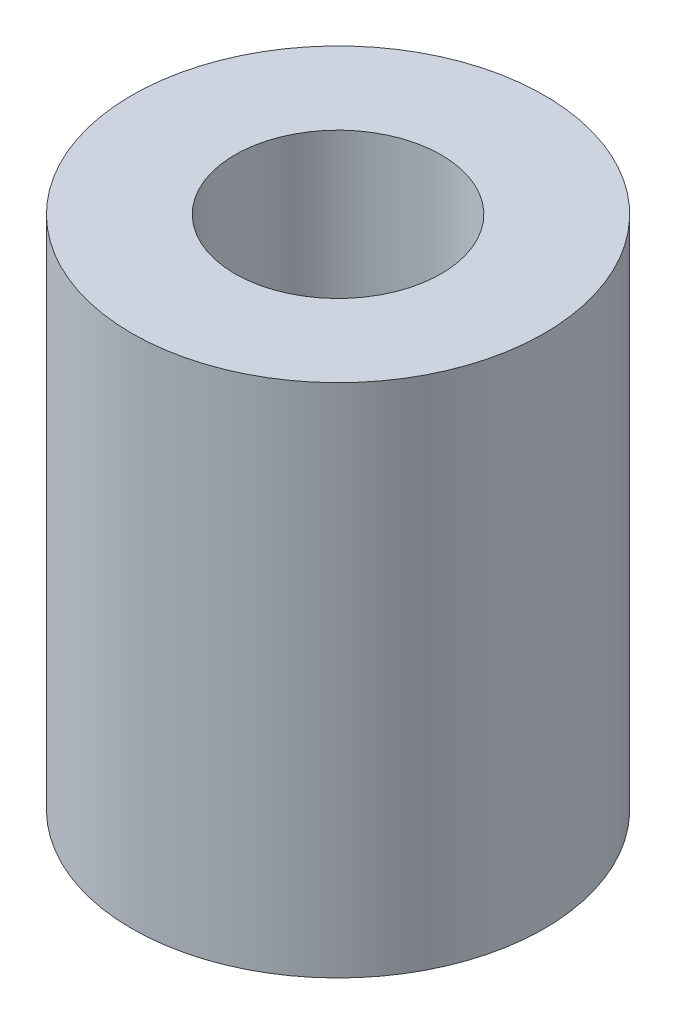
from build123d import *

# Parameters (mm, degrees)
SKETCH1_R           = 2
SKETCH1_R_2         = 1
BOSS_EXTRUDE1_DEPTH = 5


with BuildPart() as part:
    # Sketch1 → Boss-Extrude1 (new body)
    with BuildSketch(Plane(origin=(0, 0, 0), x_dir=(1, 0, 0), z_dir=(0, 1, 0))):
        with Locations(Location((0, 0, 0), (0, 0, 270))):
            Circle(SKETCH1_R)
        with Locations(Location((0, 0, 0), (0, 0, 270))):
            Circle(SKETCH1_R_2, mode=Mode.SUBTRACT)
    extrude(amount=BOSS_EXTRUDE1_DEPTH)


solid = part.part
